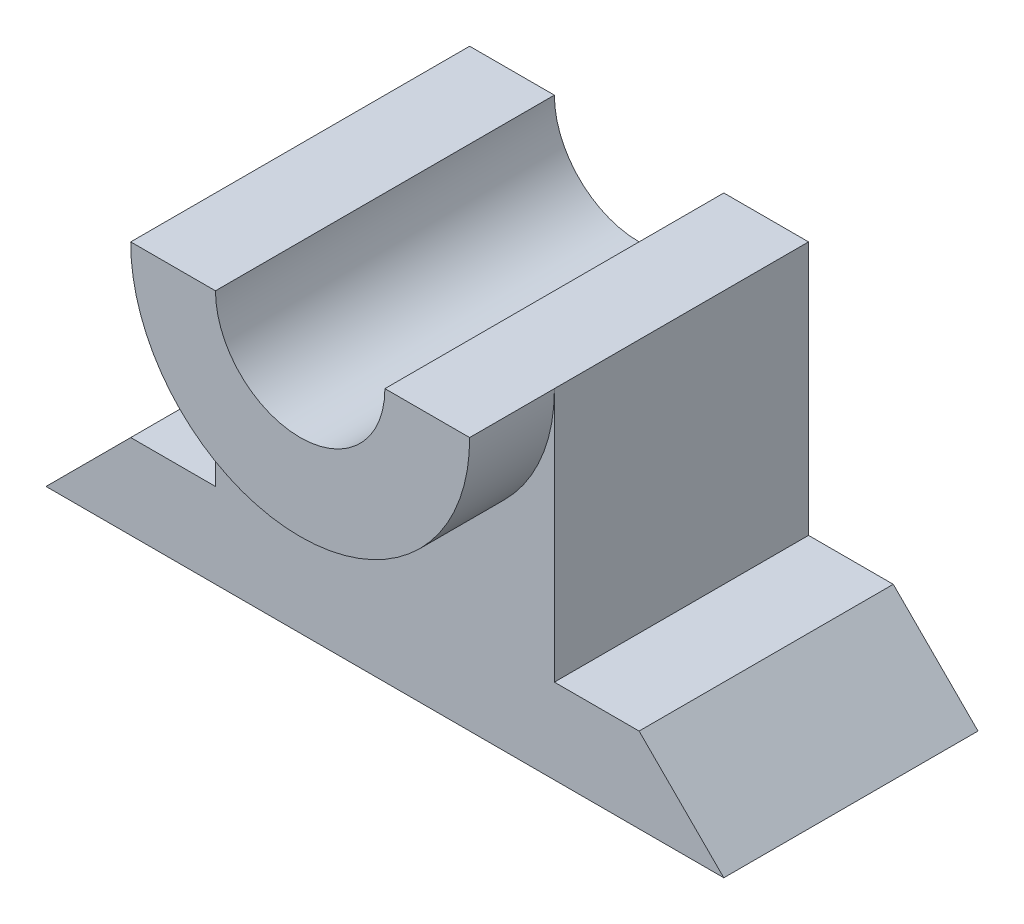
from build123d import *

# Parameters (mm, degrees)
EXTRUDE_1_DEPTH     = 30
EXTRUDE_2_DEPTH     = 10
CUT_EXTRUDE_1_DEPTH = 70


with BuildPart() as part:
    # 草圖1 → 填料-伸長1 (new body)
    with BuildSketch(Plane.XY):
        Polygon((-40, 0), (40, 0), (30, 10), (20, 10), (20, 40), (-20, 40), (-20, 10), (-30, 10), align=None)
    extrude(amount=EXTRUDE_1_DEPTH)

    # 草圖2 → 填料-伸長2 (add)
    with BuildSketch(Plane.XY.offset(30)):
        with BuildLine():
            Line((-20, 40), (20, 40))
            ThreePointArc((20, 40), (0, 19.871866441), (-20, 40))
        make_face()
    extrude(amount=EXTRUDE_2_DEPTH)

    # 草圖3 → 除料-伸長1 (cut)
    with BuildSketch(Plane.XY.offset(40)):
        with BuildLine():
            Line((10, 40), (-10, 40))
            ThreePointArc((-10, 40), (0, 30), (10, 40))
        make_face()
    extrude(amount=-CUT_EXTRUDE_1_DEPTH, mode=Mode.SUBTRACT)


solid = part.part
